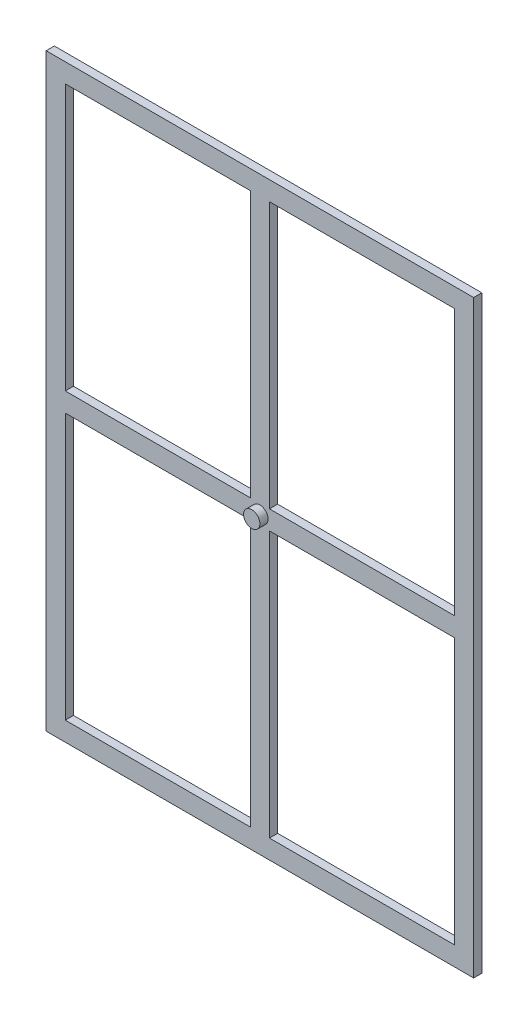
from build123d import *

# Parameters (mm, degrees)
ESBO_O1_W                = 156.68
ESBO_O1_H                = 216
ESBO_O1_W_2              = 67.84
ESBO_O1_H_2              = 97.5
RESSALTO_EXTRUS_O1_DEPTH = 3
ESBO_O2_R                = 3
RESSALTO_EXTRUS_O2_DEPTH = 3
ESBO_O3_R                = 2
CORTE_EXTRUS_O1_DEPTH    = 1


with BuildPart() as part:
    # Esboço1 → Ressalto-extrusão1 (new body)
    with BuildSketch(Plane.XY):
        Rectangle(ESBO_O1_W, ESBO_O1_H)
        with Locations((-37.42, 52.25)):
            Rectangle(ESBO_O1_W_2, ESBO_O1_H_2, mode=Mode.SUBTRACT)
        with Locations((37.42, 52.25)):
            Rectangle(ESBO_O1_W_2, ESBO_O1_H_2, mode=Mode.SUBTRACT)
        with Locations((-37.42, -52.25)):
            Rectangle(ESBO_O1_W_2, ESBO_O1_H_2, mode=Mode.SUBTRACT)
        with Locations((37.42, -52.25)):
            Rectangle(ESBO_O1_W_2, ESBO_O1_H_2, mode=Mode.SUBTRACT)
    extrude(amount=RESSALTO_EXTRUS_O1_DEPTH)

    # Esboço2 → Ressalto-extrusão2 (add)
    with BuildSketch(Plane.XY.offset(3)):
        Circle(ESBO_O2_R)
    extrude(amount=RESSALTO_EXTRUS_O2_DEPTH)

    # Esboço3 → Corte-extrusão1 (cut)
    with BuildSketch(Plane(origin=(0, 0, 0), x_dir=(-1, 0, 0), z_dir=(0, 0, -1))):
        with Locations((-74.34, 104)):
            Circle(ESBO_O3_R)
        with Locations((74.34, 104)):
            Circle(ESBO_O3_R)
        with Locations((74.34, -104)):
            Circle(ESBO_O3_R)
        with Locations((-74.34, -104)):
            Circle(ESBO_O3_R)
    extrude(amount=-CORTE_EXTRUS_O1_DEPTH, mode=Mode.SUBTRACT)


solid = part.part
